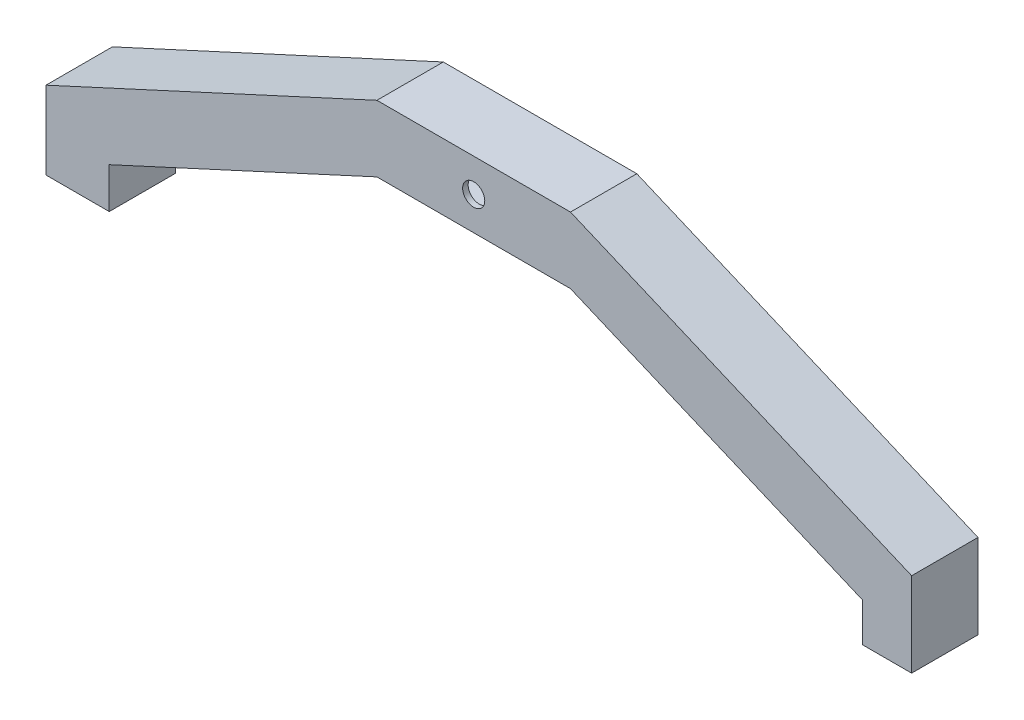
from build123d import *

# Parameters (mm, degrees)
BOSS_EXTRUDE1_DEPTH = 12
SHELL1_T            = -1
SKETCH2_W           = 10
SKETCH2_H           = 10
CUT_EXTRUDE1_DEPTH  = 12
SKETCH3_R           = 2
CUT_EXTRUDE2_DEPTH  = 12
SKETCH5_W           = 0.21800788
SKETCH5_H           = 12
CUT_EXTRUDE3_DEPTH  = 1.937482958


with BuildPart() as part:
    # Sketch1 → Boss-Extrude1 (new body)
    with BuildSketch(Plane.XY):
        Polygon((-17.5, 6), (-77.342905627, -21.549973615), (-77.342905627, -35.63), (-65.906288607, -35.63), (-65.906288607, -28.284880053), (-17.5, -6), (17.5, -6), (70.263903397, -28.328632203), (70.263903397, -35.368537604), (79.19497343, -35.368537604), (79.19497343, -20.108083023), (17.5, 6), align=None)
    extrude(amount=BOSS_EXTRUDE1_DEPTH)

    # Shell1
    shell1_openings = [part.faces().sort_by_distance(p)[0] for p in [
        (-71.624597117, -35.63, 6),
    ]]
    offset(amount=SHELL1_T, openings=shell1_openings, kind=Kind.INTERSECTION)

    # Sketch2 → Cut-Extrude1 (cut)
    with BuildSketch(Plane.XZ.offset(35.63)):
        with Locations((89.157094373, 6.101364163)):
            Rectangle(SKETCH2_W, SKETCH2_H)
    extrude(amount=-CUT_EXTRUDE1_DEPTH, mode=Mode.SUBTRACT)

    # Sketch3 → Cut-Extrude2 (cut)
    with BuildSketch(Plane.XY.offset(12)):
        Circle(SKETCH3_R)
    extrude(amount=-CUT_EXTRUDE2_DEPTH, mode=Mode.SUBTRACT)

    # Sketch5 → Cut-Extrude3 (cut)
    with BuildSketch(Plane.XZ.offset(35.63)):
        with Locations((83.048090433, 6)):
            Rectangle(SKETCH5_W, SKETCH5_H)
    extrude(amount=-CUT_EXTRUDE3_DEPTH, mode=Mode.SUBTRACT)


solid = part.part
